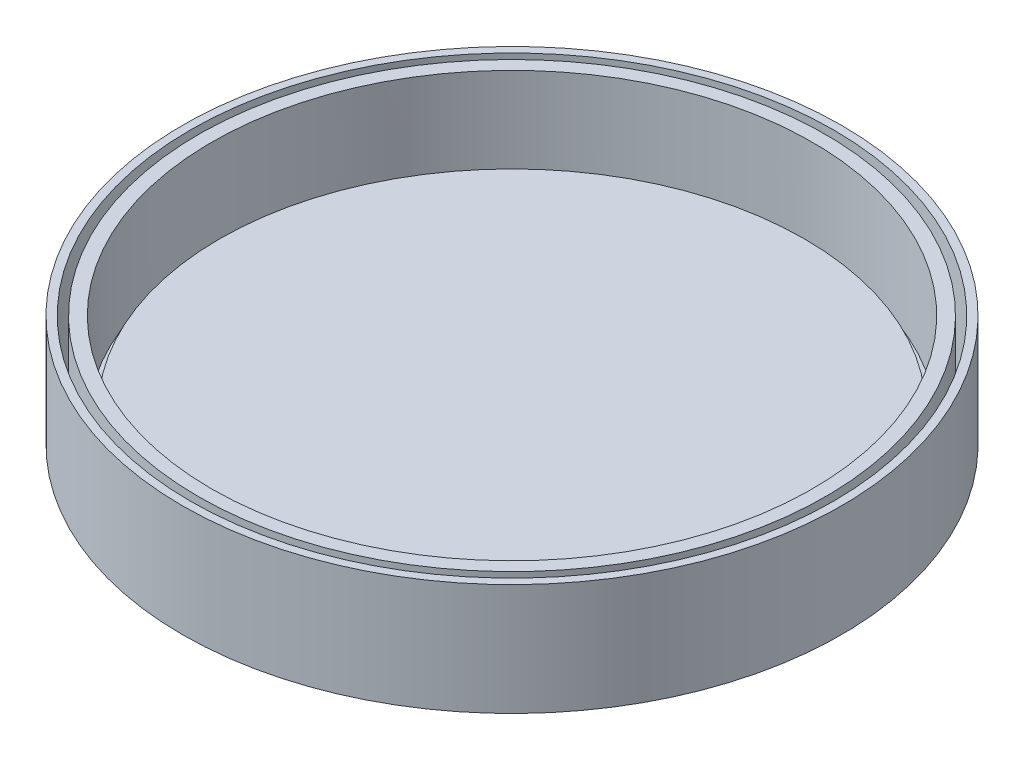
from build123d import *

# Parameters (mm, degrees)
BOSS_EXTRUDE1_DEPTH        = 20
BOSS_EXTRUDE1_DEPTH_BACK   = 1
SKETCH2_R                  = 55
BOSS_EXTRUDE1_2_DEPTH      = 20
BOSS_EXTRUDE1_2_DEPTH_BACK = 1
SKETCH2_R_2                = 59
SKETCH2_R_3                = 56.5
BOSS_EXTRUDE1_3_DEPTH      = 20
BOSS_EXTRUDE1_3_DEPTH_BACK = 1
SKETCH2_R_4                = 62
SKETCH2_R_5                = 60.5
SKETCH6_R                  = 55
CUT_EXTRUDE1_DEPTH         = 15
SKETCH7_R                  = 56.5
SKETCH7_R_2                = 55
BOSS_EXTRUDE3_DEPTH        = 3.080746367


with BuildPart() as part:
    # Sketch2 → Boss-Extrude1 (new, two sides: drawn at the far end of the back side and taken through both)
    with BuildSketch(Plane(origin=(0, 0, 0), x_dir=(1, 0, 0), z_dir=(0, 1, 0)).offset(-BOSS_EXTRUDE1_DEPTH_BACK)):
        with Locations(Location((0, 0, 0), (0, 0, 270))):
            Circle(SKETCH2_R)
    extrude(amount=BOSS_EXTRUDE1_DEPTH + BOSS_EXTRUDE1_DEPTH_BACK)

    # Sketch6 → Cut-Extrude1 (cut)
    with BuildSketch(Plane(origin=(0, 20, 0), x_dir=(1, 0, 0), z_dir=(0, 1, 0))):
        with Locations(Location((0, 0, 0), (0, 0, 270))):
            Circle(SKETCH6_R)
    extrude(amount=-CUT_EXTRUDE1_DEPTH, mode=Mode.SUBTRACT)



with BuildPart() as body_2:
    # Sketch2 → Boss-Extrude1 2 (new, two sides: drawn at the far end of the back side and taken through both)
    with BuildSketch(Plane(origin=(0, 0, 0), x_dir=(1, 0, 0), z_dir=(0, 1, 0)).offset(-BOSS_EXTRUDE1_2_DEPTH_BACK)):
        with Locations(Location((0, 0, 0), (0, 0, 270))):
            Circle(SKETCH2_R_2)
        with Locations(Location((0, 0, 0), (0, 0, 270))):
            Circle(SKETCH2_R_3, mode=Mode.SUBTRACT)
    extrude(amount=BOSS_EXTRUDE1_2_DEPTH + BOSS_EXTRUDE1_2_DEPTH_BACK)


with BuildPart() as body_3:
    # Sketch2 → Boss-Extrude1 3 (new, two sides: drawn at the far end of the back side and taken through both)
    with BuildSketch(Plane(origin=(0, 0, 0), x_dir=(1, 0, 0), z_dir=(0, 1, 0)).offset(-BOSS_EXTRUDE1_3_DEPTH_BACK)):
        with Locations(Location((0, 0, 0), (0, 0, 270))):
            Circle(SKETCH2_R_4)
        with Locations(Location((0, 0, 0), (0, 0, 270))):
            Circle(SKETCH2_R_5, mode=Mode.SUBTRACT)
    extrude(amount=BOSS_EXTRUDE1_3_DEPTH + BOSS_EXTRUDE1_3_DEPTH_BACK)


with BuildPart() as part_1:
    add(part.part)

    add(body_2.part)  # Boss-Extrude3 merges body 2
    # Sketch7 → Boss-Extrude3 (add)
    with BuildSketch(Plane.XZ.offset(1)):
        with Locations(Location((0, 0, 0), (0, 0, 90))):
            Circle(SKETCH7_R)
        with Locations(Location((0, 0, 0), (0, 0, 90))):
            Circle(SKETCH7_R_2, mode=Mode.SUBTRACT)
    extrude(amount=-BOSS_EXTRUDE3_DEPTH)


solid = Compound([body_3.part, part_1.part])
